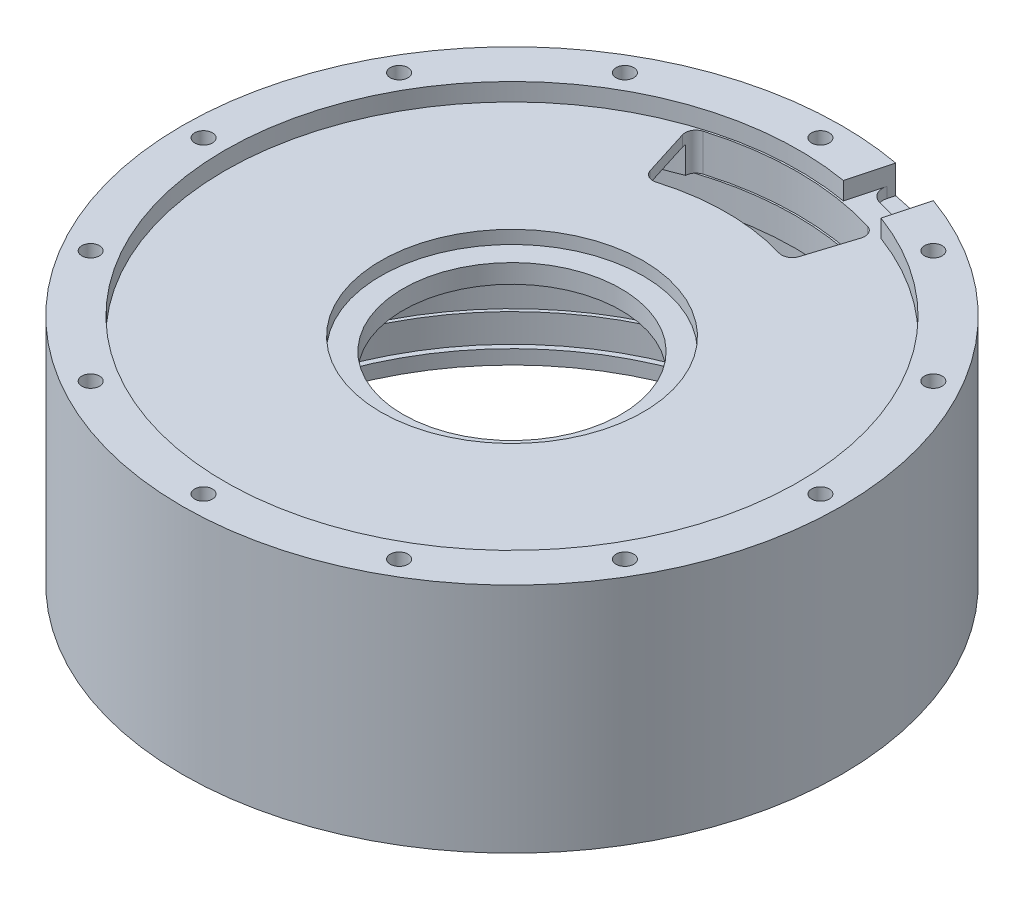
from build123d import *

# Parameters (mm, degrees)
M6_TAPPED_HOLE1_AT_2_COUNT  = 2
M6_TAPPED_HOLE1_AT_2_PITCH  = 45.034513848
M6_TAPPED_HOLE1_AT_3_COUNT  = 2
M6_TAPPED_HOLE1_AT_3_PITCH  = 87
M6_TAPPED_HOLE1_AT_4_COUNT  = 2
M6_TAPPED_HOLE1_AT_4_PITCH  = 123.036579926
M6_TAPPED_HOLE1_AT_5_COUNT  = 2
M6_TAPPED_HOLE1_AT_5_PITCH  = 150.688420258
M6_TAPPED_HOLE1_AT_6_COUNT  = 2
M6_TAPPED_HOLE1_AT_6_PITCH  = 168.071093774
M6_TAPPED_HOLE1_AT_7_COUNT  = 2
M6_TAPPED_HOLE1_AT_7_PITCH  = 174
M6_TAPPED_HOLE1_AT_8_COUNT  = 2
M6_TAPPED_HOLE1_AT_8_PITCH  = 168.071093774
M6_TAPPED_HOLE1_AT_9_COUNT  = 2
M6_TAPPED_HOLE1_AT_9_PITCH  = 150.688420258
M6_TAPPED_HOLE1_AT_10_COUNT = 2
M6_TAPPED_HOLE1_AT_10_PITCH = 123.036579926
M6_TAPPED_HOLE1_AT_11_COUNT = 2
M6_TAPPED_HOLE1_AT_11_PITCH = 87
M6_TAPPED_HOLE1_AT_12_COUNT = 2
M6_TAPPED_HOLE1_AT_12_PITCH = 45.034513848
CUT_EXTRUDE1_DEPTH          = 15.5
CUT_EXTRUDE2_DEPTH          = 5
CUT_EXTRUDE3_START          = -3
CUT_EXTRUDE3_DEPTH          = 3


with BuildPart() as part:
    # Sketch2 → Revolve1 (revolve)
    with BuildSketch(Plane.XY, mode=Mode.PRIVATE) as revolve1_sk:
        Polygon((81, 8), (81, 40), (80, 40), (80, 48), (78.5, 48), (78.5, 56.5), (81, 57.5), (81, 63.5), (93, 63.5), (93, 60.5), (93, -2), (89, -2), (89, 8), align=None)
    revolve(revolve1_sk.sketch.rotate(Axis((0, 0, 0), (0, 1, 0)), 90), axis=Axis((0, 0, 0), (0, 1, 0)))

    # Sketch15 → Revolve3 (revolve)
    with BuildSketch(Plane.XY, mode=Mode.PRIVATE) as revolve3_sk:
        Polygon((37, 57.8), (37, 54.8), (30.75, 54.8), (30.75, 49.5), (40.75, 49.5), (40.75, 55.5), (78.5, 55.5), (78.5, 56.5), (81, 57.5), (81, 58.5), (37, 58.5), align=None)
    revolve(revolve3_sk.sketch.rotate(Axis((0, 60.772219232, 0), (0, -1, 0)), 90), axis=Axis((0, 60.772219232, 0), (0, -1, 0)))

    # Sketch11 → M6 Tapped Hole1 (revolve, cut)
    with BuildSketch(Plane(origin=(0, 63.5, -87), x_dir=(0, 0, 1), z_dir=(1, 0, 0))):
        Polygon((0, 0), (0, 16.502151548), (2.5, 15), (2.5, 0), align=None)
    m6_tapped_hole1 = revolve(axis=Axis((0, 69.85, -87), (0, -1, 0)), mode=Mode.SUBTRACT)

    # M6 Tapped Hole1 at 2: M6 Tapped Hole1 ×2
    with Locations(*[Vector(0.9659258262890639, 0, 0.2588190451025372) * (i * M6_TAPPED_HOLE1_AT_2_PITCH) for i in range(1, M6_TAPPED_HOLE1_AT_2_COUNT)]):
        add(m6_tapped_hole1, mode=Mode.SUBTRACT)

    # M6 Tapped Hole1 at 3: M6 Tapped Hole1 ×2
    with Locations(*[Vector(0.8660254037844218, 0, 0.5000000000000291) * (i * M6_TAPPED_HOLE1_AT_3_PITCH) for i in range(1, M6_TAPPED_HOLE1_AT_3_COUNT)]):
        add(m6_tapped_hole1, mode=Mode.SUBTRACT)

    # M6 Tapped Hole1 at 4: M6 Tapped Hole1 ×2
    with Locations(*[Vector(0.7071067811865119, 0, 0.7071067811865832) * (i * M6_TAPPED_HOLE1_AT_4_PITCH) for i in range(1, M6_TAPPED_HOLE1_AT_4_COUNT)]):
        add(m6_tapped_hole1, mode=Mode.SUBTRACT)

    # M6 Tapped Hole1 at 5: M6 Tapped Hole1 ×2
    with Locations(*[Vector(0.4999999999999419, 0, 0.8660254037844722) * (i * M6_TAPPED_HOLE1_AT_5_PITCH) for i in range(1, M6_TAPPED_HOLE1_AT_5_COUNT)]):
        add(m6_tapped_hole1, mode=Mode.SUBTRACT)

    # M6 Tapped Hole1 at 6: M6 Tapped Hole1 ×2
    with Locations(*[Vector(0.2588190451024396, 0, 0.9659258262890901) * (i * M6_TAPPED_HOLE1_AT_6_PITCH) for i in range(1, M6_TAPPED_HOLE1_AT_6_COUNT)]):
        add(m6_tapped_hole1, mode=Mode.SUBTRACT)

    # M6 Tapped Hole1 at 7: M6 Tapped Hole1 ×2
    with Locations(*[(0, 0, i * M6_TAPPED_HOLE1_AT_7_PITCH) for i in range(1, M6_TAPPED_HOLE1_AT_7_COUNT)]):
        add(m6_tapped_hole1, mode=Mode.SUBTRACT)

    # M6 Tapped Hole1 at 8: M6 Tapped Hole1 ×2
    with Locations(*[Vector(-0.25881904510263437, 0, 0.9659258262890379) * (i * M6_TAPPED_HOLE1_AT_8_PITCH) for i in range(1, M6_TAPPED_HOLE1_AT_8_COUNT)]):
        add(m6_tapped_hole1, mode=Mode.SUBTRACT)

    # M6 Tapped Hole1 at 9: M6 Tapped Hole1 ×2
    with Locations(*[Vector(-0.5000000000001162, 0, 0.8660254037843715) * (i * M6_TAPPED_HOLE1_AT_9_PITCH) for i in range(1, M6_TAPPED_HOLE1_AT_9_COUNT)]):
        add(m6_tapped_hole1, mode=Mode.SUBTRACT)

    # M6 Tapped Hole1 at 10: M6 Tapped Hole1 ×2
    with Locations(*[Vector(-0.7071067811866543, 0, 0.7071067811864408) * (i * M6_TAPPED_HOLE1_AT_10_PITCH) for i in range(1, M6_TAPPED_HOLE1_AT_10_COUNT)]):
        add(m6_tapped_hole1, mode=Mode.SUBTRACT)

    # M6 Tapped Hole1 at 11: M6 Tapped Hole1 ×2
    with Locations(*[Vector(-0.8660254037845226, 0, 0.49999999999985456) * (i * M6_TAPPED_HOLE1_AT_11_PITCH) for i in range(1, M6_TAPPED_HOLE1_AT_11_COUNT)]):
        add(m6_tapped_hole1, mode=Mode.SUBTRACT)

    # M6 Tapped Hole1 at 12: M6 Tapped Hole1 ×2
    with Locations(*[Vector(-0.9659258262891162, 0, 0.2588190451023424) * (i * M6_TAPPED_HOLE1_AT_12_PITCH) for i in range(1, M6_TAPPED_HOLE1_AT_12_COUNT)]):
        add(m6_tapped_hole1, mode=Mode.SUBTRACT)

    # Sketch13 → Cut-Extrude1 (cut)
    with BuildSketch(Plane(origin=(0, 63.5, 0), x_dir=(1, 0, 0), z_dir=(0, 1, 0))):
        with BuildLine():
            Line((-25.210193245, 73.305498815), (-21.014921414, 59.999796483))
            ThreePointArc((-21.014921414, 59.999796483), (-19.559910698, 58.251862954), (-17.296786901, 58.02692188))
            ThreePointArc((-17.296786901, 58.02692188), (0, 60.55), (17.296786901, 58.02692188))
            ThreePointArc((17.296786901, 58.02692188), (19.559910698, 58.251862954), (21.014921414, 59.999796483))
            Line((21.014921414, 59.999796483), (25.210193245, 73.305498815))
            ThreePointArc((25.210193245, 73.305498815), (25.001082253, 75.610001532), (23.214166614, 77.080169099))
            ThreePointArc((23.214166614, 77.080169099), (0, 80.5), (-23.214166614, 77.080169099))
            ThreePointArc((-23.214166614, 77.080169099), (-25.001082253, 75.610001532), (-25.210193245, 73.305498815))
        make_face()
    extrude(amount=-CUT_EXTRUDE1_DEPTH, mode=Mode.SUBTRACT)

    # Sketch19 → Cut-Extrude2 (cut)
    with BuildSketch(Plane(origin=(0, 63.5, 0), x_dir=(1, 0, 0), z_dir=(0, 1, 0))):
        Polygon((-7.244443697, 1.941142838), (40.895898692, 181.603346528), (55.384786086, 177.721060851), (7.244443697, -1.941142838), align=None)
    extrude(amount=-CUT_EXTRUDE2_DEPTH, mode=Mode.SUBTRACT)

    # Sketch27 → Cut-Extrude3 (cut)
    with BuildSketch(Plane(origin=(0, 58.5, 0), x_dir=(1, 0, 0), z_dir=(0, 1, 0)).offset(CUT_EXTRUDE3_START)):
        with BuildLine():
            Line((16.74732793, 91.479653515), (16.223859038, 89.526041012))
            ThreePointArc((16.223859038, 89.526041012), (16.623460728, 86.490764831), (19.052286162, 84.627061526))
            Line((19.052286162, 84.627061526), (25.813766946, 82.815328211))
            ThreePointArc((25.813766946, 82.815328211), (28.849043127, 83.214929901), (30.712746432, 85.643755335))
            Line((30.712746432, 85.643755335), (31.236215324, 87.597367838))
            ThreePointArc((31.236215324, 87.597367838), (24.070171195, 89.831101845), (16.74732793, 91.479653515))
        make_face()
    extrude(amount=CUT_EXTRUDE3_DEPTH, mode=Mode.SUBTRACT)


with BuildPart() as body_2:
    # Sketch3 → Revolve2 (revolve)
    with BuildSketch(Plane.XY, mode=Mode.PRIVATE) as revolve2_sk:
        Polygon((80, 8), (80, 0), (78.5, 0), (78.5, -4), (89, -4), (89, 8), align=None)
    revolve(revolve2_sk.sketch.rotate(Axis((0, -0.3, 0), (0, -1, 0)), 90), axis=Axis((0, -0.3, 0), (0, -1, 0)))


solid = Compound([part.part, body_2.part])
